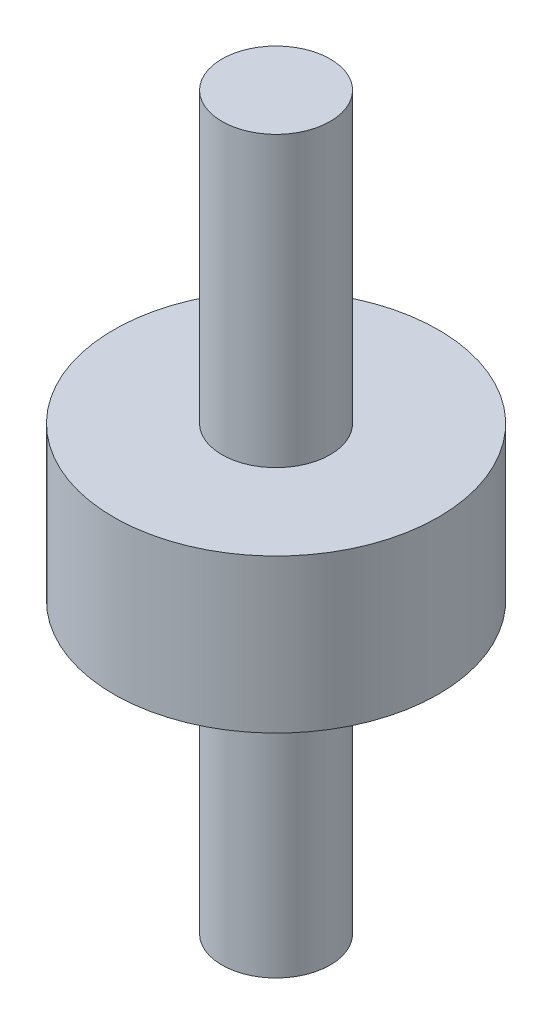
from build123d import *


with BuildPart() as part:
    # Sketch1 → Revolve1 (revolve)
    with BuildSketch(Plane.XY, mode=Mode.PRIVATE) as revolve1_sk:
        Polygon((0, 40.5), (-3, 40.5), (-3, 24.5), (-9, 24.5), (-9, 16), (-3, 16), (-3, 0), (0, 0), align=None)
    revolve(revolve1_sk.sketch.rotate(Axis((0, 0, 0), (0, 1, 0)), 180), axis=Axis((0, 0, 0), (0, 1, 0)))


solid = part.part
